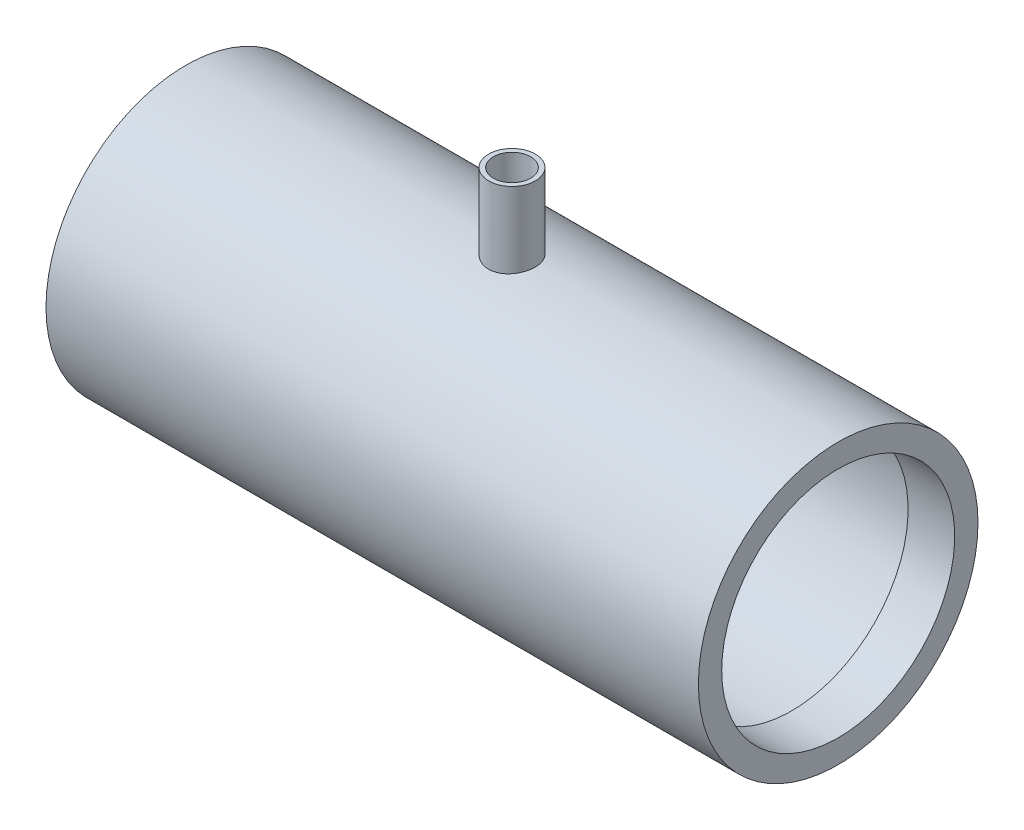
from build123d import *

# Parameters (mm, degrees)
SKETCH1_R           = 15
SKETCH1_R_2         = 14
BOSS_EXTRUDE1_DEPTH = 30
SKETCH2_R           = 15
SKETCH2_R_2         = 12.5
BOSS_EXTRUDE2_DEPTH = 5
SKETCH4_R           = 2.5
BOSS_EXTRUDE3_DEPTH = 23
SKETCH3_R           = 2
CUT_EXTRUDE1_DEPTH  = 35
SKETCH5_R           = 14
CUT_EXTRUDE2_DEPTH  = 53


with BuildPart() as part:
    # Sketch1 → Boss-Extrude1 (new, symmetric)
    with BuildSketch(Plane(origin=(0, 0, 0), x_dir=(0, 0, -1), z_dir=(1, 0, 0))):
        with Locations(Location((0, 0, 0), (0, 0, 180))):
            Circle(SKETCH1_R)
        with Locations(Location((0, 0, 0), (0, 0, 180))):
            Circle(SKETCH1_R_2, mode=Mode.SUBTRACT)
    extrude(amount=BOSS_EXTRUDE1_DEPTH, both=True)

    # Sketch2 → Boss-Extrude2 (add)
    with BuildSketch(Plane.ZY.offset(30)):
        Circle(SKETCH2_R)
        Circle(SKETCH2_R_2, mode=Mode.SUBTRACT)
    boss_extrude2 = extrude(amount=BOSS_EXTRUDE2_DEPTH)

    # Mirror1: Boss-Extrude2 across plane
    add(boss_extrude2.mirror(Plane(origin=(0, 0, 0), x_dir=(0, 0, 1), z_dir=(1, 0, 0))))

    # Sketch4 → Boss-Extrude3 (add)
    with BuildSketch(Plane(origin=(0, 0, 0), x_dir=(1, 0, 0), z_dir=(0, 1, 0))):
        with Locations(Location((0, 0, 0), (0, 0, 90))):
            Circle(SKETCH4_R)
    extrude(amount=BOSS_EXTRUDE3_DEPTH)

    # Sketch3 → Cut-Extrude1 (cut)
    with BuildSketch(Plane(origin=(0, 0, 0), x_dir=(1, 0, 0), z_dir=(0, 1, 0))):
        with Locations(Location((0, 0, 0), (0, 0, 270))):
            Circle(SKETCH3_R)
    extrude(amount=CUT_EXTRUDE1_DEPTH, mode=Mode.SUBTRACT)

    # Sketch5 → Cut-Extrude2 (cut)
    with BuildSketch(Plane(origin=(-30, 0, 0), x_dir=(0, 0, -1), z_dir=(1, 0, 0))):
        Circle(SKETCH5_R)
    extrude(amount=CUT_EXTRUDE2_DEPTH, mode=Mode.SUBTRACT)


solid = part.part
